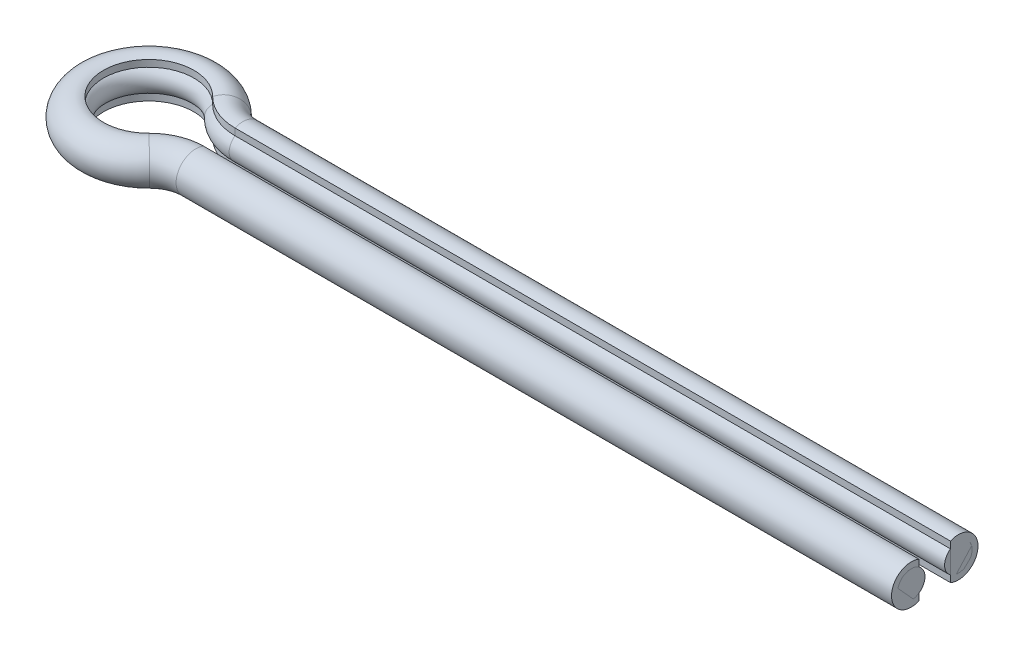
from build123d import *

# Parameters (mm, degrees)
SKETCH5_R = 1.75


with BuildPart() as part:
    # Sweep1: sweep along a path in Sketch1
    with BuildLine(Plane(origin=(0, 0, 0), x_dir=(1, 0, 0), z_dir=(0, 1, 0))) as sweep1_path:
        Line((50, -3), (-41.020857502, -3))
        ThreePointArc((-41.020857502, -3), (-43.284942951, -3.453787767), (-45.199270348, -4.745049505))
        ThreePointArc((-45.199270348, -4.745049505), (-56.75, 0), (-45.199270348, 4.745049505))
        ThreePointArc((-45.199270348, 4.745049505), (-43.284942951, 3.453787767), (-41.020857502, 3))
        Line((-41.020857502, 3), (50, 3))
    # Sketch5 → Sweep1 (sweep)
    with BuildSketch(Plane(origin=(50, 0, -3), x_dir=(0, 0, -1), z_dir=(1, 0, 0))):
        Circle(SKETCH5_R)
    sweep(path=sweep1_path.line)


with BuildPart() as body_2:
    # Sweep3: sweep along a path in Sketch1<3>
    with BuildLine(Plane(origin=(0, 0, 0), x_dir=(1, 0, 0), z_dir=(0, 1, 0))) as sweep3_path:
        Line((50, -3), (-41.020857502, -3))
        ThreePointArc((-41.020857502, -3), (-43.284942951, -3.453787767), (-45.199270348, -4.745049505))
        ThreePointArc((-45.199270348, -4.745049505), (-56.75, 0), (-45.199270348, 4.745049505))
        ThreePointArc((-45.199270348, 4.745049505), (-43.284942951, 3.453787767), (-41.020857502, 3))
        Line((-41.020857502, 3), (50, 3))
    # Sketch9 → Sweep3 (sweep)
    with BuildSketch(Plane(origin=(50, 0, -3), x_dir=(0, 0, -1), z_dir=(1, 0, 0))):
        with BuildLine():
            Line((-1, 2.291287847), (-1, -2.291287847))
            ThreePointArc((-1, -2.291287847), (2.5, 0), (-1, 2.291287847))
        make_face()
    sweep(path=sweep3_path.line)


solid = Compound([part.part, body_2.part])
